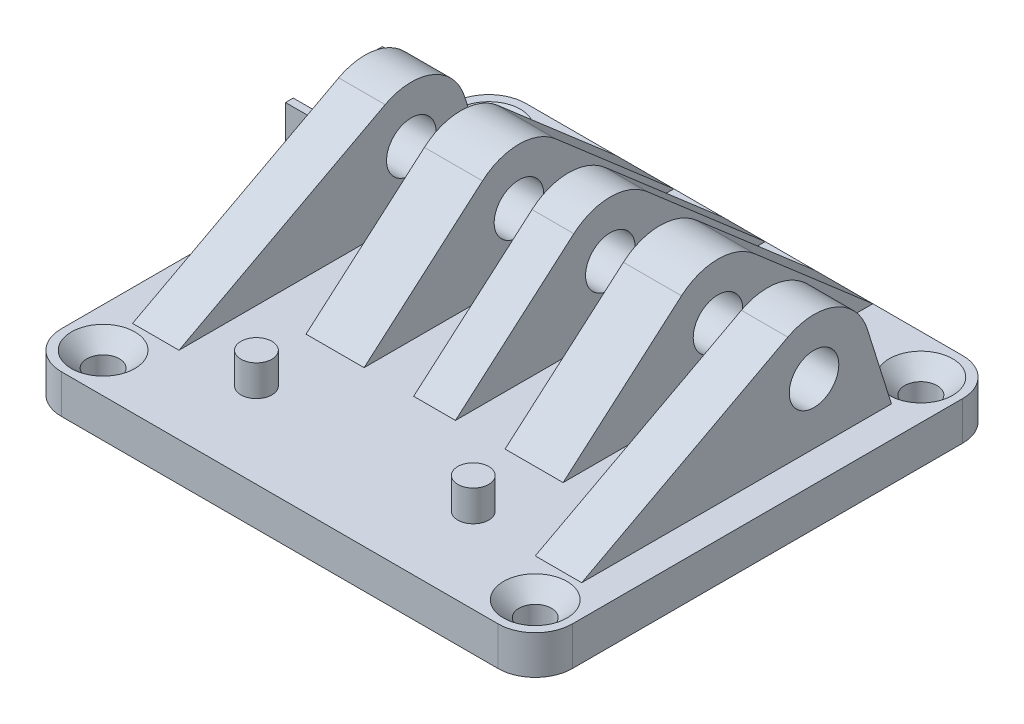
from build123d import *

# Parameters (mm, degrees)
SKETCH4_W           = 6.4
SKETCH4_H           = 40
SKETCH4_W_2         = 5.4
SKETCH4_W_3         = 7.5
BOSS_EXTRUDE4_DEPTH = 5
SKETCH6_W           = 5.4
SKETCH6_H           = 40
SKETCH6_W_2         = 7.5
BOSS_EXTRUDE5_DEPTH = 15
SKETCH7_R           = 3.2
CUT_EXTRUDE2_DEPTH  = 73.625684162
CUT_EXTRUDE3_REACH  = 74.626
CUT_EXTRUDE4_REACH  = 90.566
CUT_EXTRUDE5_REACH  = 92.449
SKETCH10_R          = 2.1
CHAMFER1_SIZE       = 2
FILLET1_R           = 4.8
SKETCH11_R          = 2
BOSS_EXTRUDE6_DEPTH = 4
BOSS_EXTRUDE7_DEPTH = 4


with BuildPart() as part:
    # Sketch4 → Boss-Extrude4 (new body)
    with BuildSketch(Plane(origin=(0, 0, 0), x_dir=(1, 0, 0), z_dir=(0, 1, 0))):
        Polygon((0, 60), (0, 0), (66, 0), (66, 60), (56, 60), (56, 50), (62, 50), (62, 10), (56, 10), (56, 20), (49.6, 20), (42.1, 20), (35.7, 20), (30.3, 20), (30.3, 60), align=None)
        with Locations((38.9, 40)):
            Rectangle(SKETCH4_W, SKETCH4_H)
        with Locations((33, 40)):
            Rectangle(SKETCH4_W_2, SKETCH4_H)
        with Locations((45.85, 40)):
            Rectangle(SKETCH4_W_3, SKETCH4_H)
        Polygon((56, 50), (56, 60), (49.6, 60), (49.6, 20), (56, 20), align=None)
        Polygon((62, 50), (56, 50), (56, 20), (56, 10), (62, 10), align=None)
    extrude(amount=BOSS_EXTRUDE4_DEPTH)

    # Sketch6 → Boss-Extrude5 (add)
    with BuildSketch(Plane(origin=(0, 5, 0), x_dir=(1, 0, 0), z_dir=(0, 1, 0))):
        with Locations((33, 40)):
            Rectangle(SKETCH6_W, SKETCH6_H)
        with Locations((45.85, 40)):
            Rectangle(SKETCH6_W_2, SKETCH6_H)
        Polygon((62, 50), (56, 50), (56, 20), (56, 10), (62, 10), align=None)
    boss_extrude5 = extrude(amount=BOSS_EXTRUDE5_DEPTH)

    # Sketch7 → Cut-Extrude2 (cut, through all)
    with BuildSketch(Plane.ZY.offset(-30.3)):
        with Locations(Location((-40, 12.8, 0), (0, 0, 180))):
            Circle(SKETCH7_R)
    cut_extrude2 = extrude(amount=-CUT_EXTRUDE2_DEPTH, mode=Mode.SUBTRACT)

    # Cut-Extrude3: up to this face of the body (flat: up to its plane)
    cut_extrude3_end = Plane(part.part.faces().sort_by_distance((49.6, 12.5, -20.427200187))[0])
    # Sketch8 → Cut-Extrude3 (cut, up to the picked face)
    with BuildSketch(Plane.ZY.offset(-30.3), mode=Mode.PRIVATE) as cut_extrude3_sk1:
        with BuildLine():
            Line((-60, 20), (-60, 5))
            Line((-60, 5), (-44.714360106, 18.241948989))
            ThreePointArc((-44.714360106, 18.241948989), (-42.515747134, 19.546185319), (-40, 20))
            Line((-40, 20), (-60, 20))
        make_face()
    cut_extrude3_tool1 = split(extrude(cut_extrude3_sk1.sketch, amount=-CUT_EXTRUDE3_REACH, mode=Mode.PRIVATE), bisect_by=cut_extrude3_end, keep=Keep.BOTH, mode=Mode.PRIVATE)
    # Sketch8 → Cut-Extrude3 (cut, up to the picked face)
    with BuildSketch(Plane.ZY.offset(-30.3), mode=Mode.PRIVATE) as cut_extrude3_sk2:
        with BuildLine():
            Line((-35.285639894, 18.241948989), (-20, 5))
            Line((-20, 5), (-20, 20))
            Line((-20, 20), (-40, 20))
            ThreePointArc((-40, 20), (-37.484252866, 19.546185319), (-35.285639894, 18.241948989))
        make_face()
    cut_extrude3_tool2 = split(extrude(cut_extrude3_sk2.sketch, amount=-CUT_EXTRUDE3_REACH, mode=Mode.PRIVATE), bisect_by=cut_extrude3_end, keep=Keep.BOTH, mode=Mode.PRIVATE)
    cut_extrude3_1 = cut_extrude3_tool1.solids().sort_by(Axis((30.3, 15.029403, -54.154339), (1, 0, 0)))[0]
    add(cut_extrude3_1, mode=Mode.SUBTRACT)
    cut_extrude3_2 = cut_extrude3_tool2.solids().sort_by(Axis((30.3, 15.029403, -25.845661), (1, 0, 0)))[0]
    add(cut_extrude3_2, mode=Mode.SUBTRACT)
    cut_extrude3 = cut_extrude3_1 + cut_extrude3_2  # Cut-Extrude3 as one shape, for the pattern or mirror that repeats it

    # Sketch9 → Cut-Extrude4 (cut, up to next)
    with BuildSketch(Plane(origin=(62, 0, 0), x_dir=(0, 0, -1), z_dir=(1, 0, 0)), mode=Mode.PRIVATE) as cut_extrude4_sk1:
        with BuildLine():
            ThreePointArc((36.619205024, 19.156903753), (38.257832819, 19.786047059), (40, 20))
            Line((40, 20), (10, 20))
            Line((10, 20), (10, 5))
            Line((10, 5), (36.619205024, 19.156903753))
        make_face()
    cut_extrude4_tool1 = extrude(cut_extrude4_sk1.sketch, amount=-CUT_EXTRUDE4_REACH, mode=Mode.PRIVATE) & part.part
    # Sketch9 → Cut-Extrude4 (cut, up to next)
    with BuildSketch(Plane(origin=(62, 0, 0), x_dir=(0, 0, -1), z_dir=(1, 0, 0)), mode=Mode.PRIVATE) as cut_extrude4_sk2:
        with BuildLine():
            ThreePointArc((40, 20), (44.259746459, 18.604701552), (46.868488023, 14.959600029))
            Line((46.868488023, 14.959600029), (50, 5))
            Line((50, 5), (50, 20))
            Line((50, 20), (40, 20))
        make_face()
    cut_extrude4_tool2 = extrude(cut_extrude4_sk2.sketch, amount=-CUT_EXTRUDE4_REACH, mode=Mode.PRIVATE) & part.part
    cut_extrude4_1 = cut_extrude4_tool1.solids().sort_by_distance((62, 15.005893, -19.424487))[0]
    add(cut_extrude4_1, mode=Mode.SUBTRACT)
    cut_extrude4_2 = cut_extrude4_tool2.solids().sort_by_distance((62, 15.504148, -47.92116))[0]
    add(cut_extrude4_2, mode=Mode.SUBTRACT)
    cut_extrude4 = cut_extrude4_1 + cut_extrude4_2  # Cut-Extrude4 as one shape, for the pattern or mirror that repeats it

    # Mirror1: Boss-Extrude5, Cut-Extrude2, Cut-Extrude3, Cut-Extrude4 across plane
    add(boss_extrude5.mirror(Plane.ZY.offset(-33)))
    add(cut_extrude2.mirror(Plane.ZY.offset(-33)), mode=Mode.SUBTRACT)
    add(cut_extrude3.mirror(Plane.ZY.offset(-33)), mode=Mode.SUBTRACT)
    add(cut_extrude4.mirror(Plane.ZY.offset(-33)), mode=Mode.SUBTRACT)

    # Sketch10 → Cut-Extrude5 (cut, up to next)
    with BuildSketch(Plane(origin=(0, 5, 0), x_dir=(1, 0, 0), z_dir=(0, 1, 0)), mode=Mode.PRIVATE) as cut_extrude5_sk1:
        with Locations(Location((5.1, 54.9, 0), (0, 0, 270))):
            Circle(SKETCH10_R)
    cut_extrude5_tool1 = extrude(cut_extrude5_sk1.sketch, amount=-CUT_EXTRUDE5_REACH, mode=Mode.PRIVATE) & part.part
    # Sketch10 → Cut-Extrude5 (cut, up to next)
    with BuildSketch(Plane(origin=(0, 5, 0), x_dir=(1, 0, 0), z_dir=(0, 1, 0)), mode=Mode.PRIVATE) as cut_extrude5_sk2:
        with Locations(Location((60.9, 54.9, 0), (0, 0, 270))):
            Circle(SKETCH10_R)
    cut_extrude5_tool2 = extrude(cut_extrude5_sk2.sketch, amount=-CUT_EXTRUDE5_REACH, mode=Mode.PRIVATE) & part.part
    # Sketch10 → Cut-Extrude5 (cut, up to next)
    with BuildSketch(Plane(origin=(0, 5, 0), x_dir=(1, 0, 0), z_dir=(0, 1, 0)), mode=Mode.PRIVATE) as cut_extrude5_sk3:
        with Locations(Location((60.9, 5.1, 0), (0, 0, 270))):
            Circle(SKETCH10_R)
    cut_extrude5_tool3 = extrude(cut_extrude5_sk3.sketch, amount=-CUT_EXTRUDE5_REACH, mode=Mode.PRIVATE) & part.part
    # Sketch10 → Cut-Extrude5 (cut, up to next)
    with BuildSketch(Plane(origin=(0, 5, 0), x_dir=(1, 0, 0), z_dir=(0, 1, 0)), mode=Mode.PRIVATE) as cut_extrude5_sk4:
        with Locations(Location((5.1, 5.1, 0), (0, 0, 270))):
            Circle(SKETCH10_R)
    cut_extrude5_tool4 = extrude(cut_extrude5_sk4.sketch, amount=-CUT_EXTRUDE5_REACH, mode=Mode.PRIVATE) & part.part
    add(cut_extrude5_tool1.solids().sort_by_distance((5.1, 5, -54.9))[0], mode=Mode.SUBTRACT)
    add(cut_extrude5_tool2.solids().sort_by_distance((60.9, 5, -54.9))[0], mode=Mode.SUBTRACT)
    add(cut_extrude5_tool3.solids().sort_by_distance((60.9, 5, -5.1))[0], mode=Mode.SUBTRACT)
    add(cut_extrude5_tool4.solids().sort_by_distance((5.1, 5, -5.1))[0], mode=Mode.SUBTRACT)

    # Chamfer1
    chamfer1_edges = [part.edges().sort_by_distance(p)[0] for p in [
        (5.1, 5, -7.2),
        (60.9, 5, -7.2),
        (60.9, 5, -57),
        (5.1, 5, -57),
    ]]
    chamfer(chamfer1_edges, length=CHAMFER1_SIZE)

    # Fillet1
    fillet1_edges = [part.edges().sort_by_distance(p)[0] for p in [
        (66, 2.5, 0),
        (0, 2.5, 0),
        (0, 2.5, -60),
        (66, 2.5, -60),
    ]]
    fillet(fillet1_edges, radius=FILLET1_R)

    # Sketch11 → Boss-Extrude6 (add)
    with BuildSketch(Plane(origin=(0, 5, 0), x_dir=(1, 0, 0), z_dir=(0, 1, 0))):
        with Locations(Location((19, 11, 0), (0, 0, 270))):
            Circle(SKETCH11_R)
        with Locations(Location((47, 11, 0), (0, 0, 270))):
            Circle(SKETCH11_R)
    extrude(amount=BOSS_EXTRUDE6_DEPTH)

    # Sketch12 → Boss-Extrude7 (add)
    with BuildSketch(Plane.ZY.offset(-4)):
        Polygon((-45.25, 9.768911087), (-45.25, 15.831088913), (-46.25, 15.831088913), (-46.25, 5), (-33.75, 5), (-33.75, 15.831088913), (-34.75, 15.831088913), (-34.75, 9.768911087), (-40, 6.737822174), align=None)
    extrude(amount=BOSS_EXTRUDE7_DEPTH)


solid = part.part
